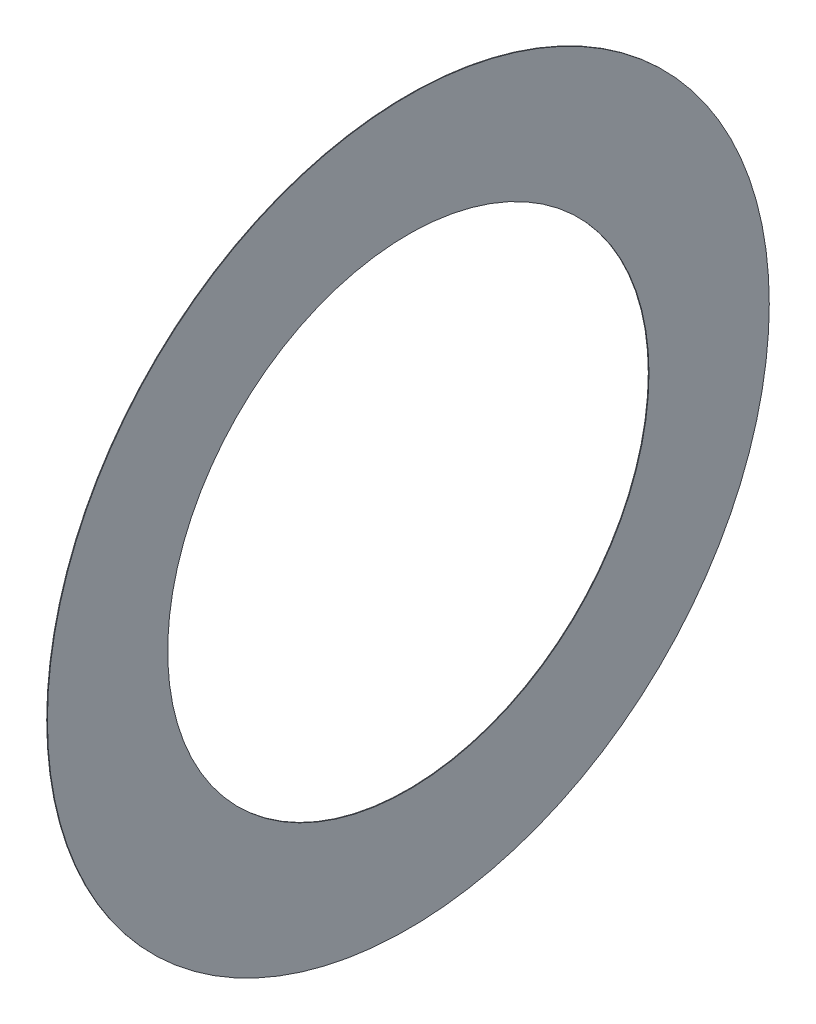
from build123d import *

# Parameters (mm, degrees)
SKETCH1_R           = 14.2875
SKETCH1_R_2         = 9.525
BOSS_EXTRUDE1_DEPTH = 0.0254


with BuildPart() as part:
    # Sketch1 → Boss-Extrude1 (new body)
    with BuildSketch(Plane(origin=(0, 0, 0), x_dir=(0, 0, -1), z_dir=(1, 0, 0))):
        Circle(SKETCH1_R)
        Circle(SKETCH1_R_2, mode=Mode.SUBTRACT)
    extrude(amount=BOSS_EXTRUDE1_DEPTH)


solid = part.part
